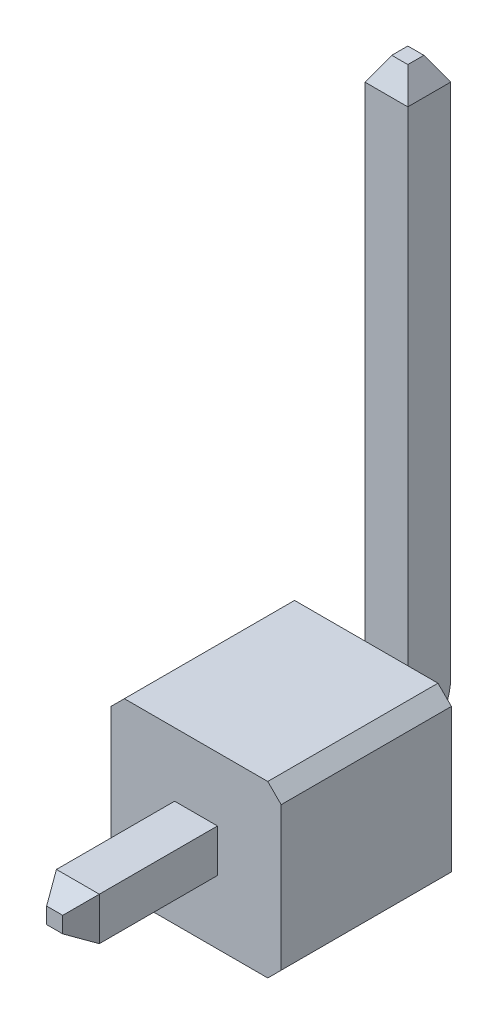
from build123d import *

# Parameters (mm, degrees)
SKETCH_2_W      = 0.64
SKETCH_2_H      = 0.64
CHAMFER_1_SIZE  = 0.2
CHAMFER_1_SIZE2 = 0.346410162
CHAMFER_2_SIZE  = 0.2
CHAMFER_2_SIZE2 = 0.346410162
SKETCH_3_W      = 2.54
SKETCH_3_H      = 2.54
EXTRUDE_1_DEPTH = 2.54
CHAMFER_3_SIZE  = 0.2


with BuildPart() as part:
    # По траектории1: sweep along a path in Эскиз1
    with BuildLine(Plane(origin=(0, 0, 0), x_dir=(0, 0, -1), z_dir=(1, 0, 0))) as sweep_1_path:
        Line((0, 0), (0, -8.04))
        ThreePointArc((0, -8.04), (-0.146446609, -8.393553391), (-0.5, -8.54))
        Line((-0.5, -8.54), (-5.27, -8.54))
    # Эскиз2 → По траектории1 (sweep)
    with BuildSketch(Plane(origin=(0, 0, 0), x_dir=(1, 0, 0), z_dir=(0, 1, 0))):
        Rectangle(SKETCH_2_W, SKETCH_2_H)
    sweep(path=sweep_1_path.line)

    # Фаска1
    chamfer_1_edges = [part.edges().sort_by_distance(p)[0] for p in [
        (0.32, -8.54, 5.27),
        (0, -8.86, 5.27),
        (-0.32, -8.54, 5.27),
        (0, -8.22, 5.27),
    ]]
    chamfer_1_side = [part.faces().sort_by_distance(p)[0] for p in [
        (0, -8.54, 5.27),
    ]]
    chamfer(chamfer_1_edges, length=CHAMFER_1_SIZE, length2=CHAMFER_1_SIZE2, reference=chamfer_1_side[0])

    # Фаска2
    chamfer_2_edges = [part.edges().sort_by_distance(p)[0] for p in [
        (0, 0, 0.32),
        (-0.32, 0, 0),
        (0, 0, -0.32),
        (0.32, 0, 0),
    ]]
    chamfer_2_side = [part.faces().sort_by_distance(p)[0] for p in [
        (0, 0, 0),
    ]]
    chamfer(chamfer_2_edges, length=CHAMFER_2_SIZE, length2=CHAMFER_2_SIZE2, reference=chamfer_2_side[0])

    # Эскиз3 → Бобышка-Вытянуть1 (add)
    with BuildSketch(Plane.XY.offset(0.62)):
        with Locations((0, -8.54)):
            Rectangle(SKETCH_3_W, SKETCH_3_H)
    extrude(amount=EXTRUDE_1_DEPTH)

    # Фаска3
    chamfer_3_edges = [part.edges().sort_by_distance(p)[0] for p in [
        (1.27, -9.81, 1.89),
        (1.27, -7.27, 1.89),
        (-1.27, -7.27, 1.89),
        (-1.27, -9.81, 1.89),
    ]]
    chamfer(chamfer_3_edges, length=CHAMFER_3_SIZE)


solid = part.part
